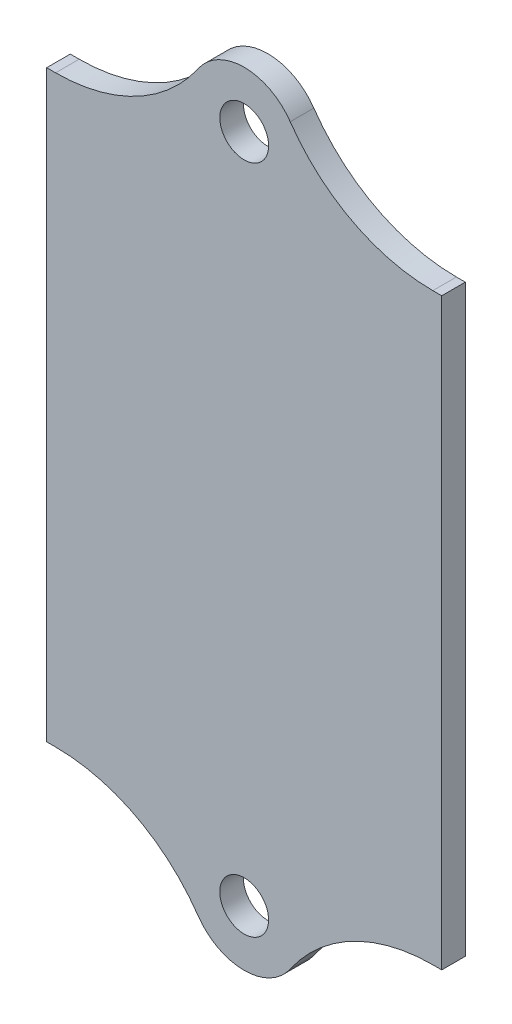
from build123d import *

# Parameters (mm, degrees)
BOSS_EXTRUDE1_DEPTH = 1.5
SKETCH2_R           = 1.55
CUT_EXTRUDE1_DEPTH  = 54.49517282


with BuildPart() as part:
    # Sketch1 → Boss-Extrude1 (new body)
    with BuildSketch(Plane.XY):
        with BuildLine():
            Line((-10.351321581, 8), (-10.351321581, 45.1))
            Line((-10.351321581, 45.1), (-9.925677234, 45.1))
            Line((-9.925677234, 45.1), (-9.786312195, 45.1))
            ThreePointArc((-9.786312195, 45.1), (-4.668121471, 46.363259082), (-0.725494549, 49.862886598))
            ThreePointArc((-0.725494549, 49.862886598), (2.198678419, 51.4), (5.122851386, 49.862886598))
            ThreePointArc((5.122851386, 49.862886598), (9.065478308, 46.363259082), (14.183669032, 45.1))
            Line((14.183669032, 45.1), (14.323034072, 45.1))
            Line((14.323034072, 45.1), (14.748678419, 45.1))
            Line((14.748678419, 45.1), (14.748678419, 8.6))
            Line((14.748678419, 8.6), (14.748678419, 8))
            Line((14.748678419, 8), (14.183669032, 8))
            ThreePointArc((14.183669032, 8), (9.065478308, 6.736740918), (5.122851386, 3.237113402))
            ThreePointArc((5.122851386, 3.237113402), (2.198678419, 1.7), (-0.725494549, 3.237113402))
            ThreePointArc((-0.725494549, 3.237113402), (-4.668121471, 6.736740918), (-9.786312195, 8))
            Line((-9.786312195, 8), (-10.351321581, 8))
        make_face()
    extrude(amount=BOSS_EXTRUDE1_DEPTH)

    # Sketch2 → Cut-Extrude1 (cut, through all)
    with BuildSketch(Plane.XY.offset(1.5)):
        with Locations((2.198678419, 47.85)):
            Circle(SKETCH2_R)
        with Locations((2.198678419, 5.25)):
            Circle(SKETCH2_R)
    extrude(amount=-CUT_EXTRUDE1_DEPTH, mode=Mode.SUBTRACT)


solid = part.part
